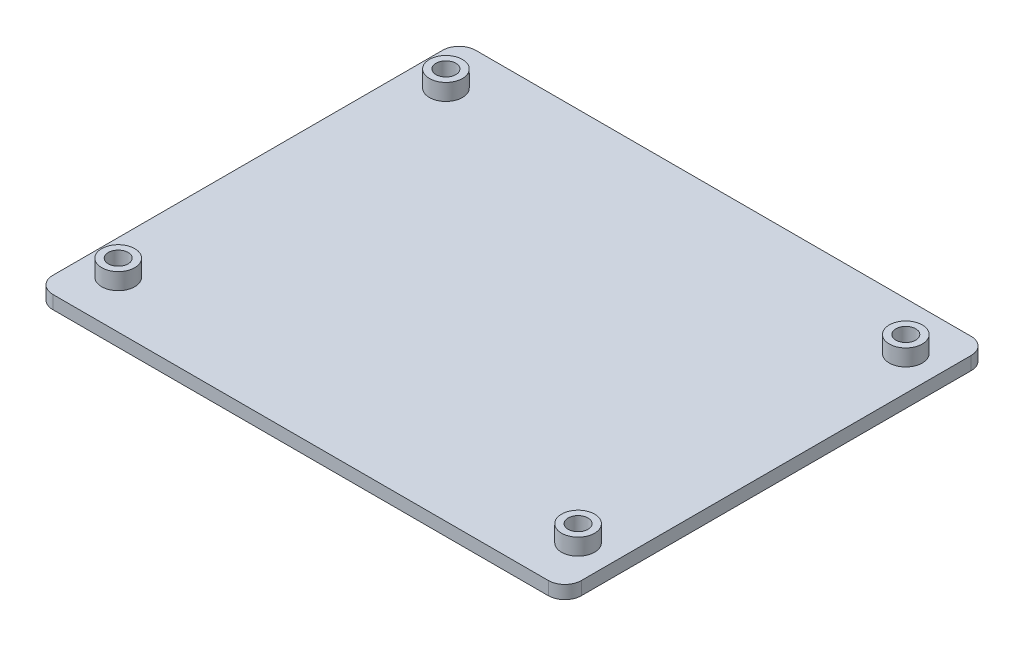
from build123d import *

# Parameters (mm, degrees)
SKETCH1_W           = 80
SKETCH1_H           = 64
BOSS_EXTRUDE1_DEPTH = 2
FILLET1_R           = 2.5
SKETCH2_R           = 1.5
CUT_EXTRUDE1_DEPTH  = 2
BOSS_EXTRUDE2_START = 2.5
SKETCH3_R           = 2.5
SKETCH3_R_2         = 1.5
BOSS_EXTRUDE2_DEPTH = 2.5


with BuildPart() as part:
    # Sketch1 → Boss-Extrude1 (new body)
    with BuildSketch(Plane(origin=(0, 0, 0), x_dir=(1, 0, 0), z_dir=(0, 1, 0))):
        Rectangle(SKETCH1_W, SKETCH1_H)
    extrude(amount=BOSS_EXTRUDE1_DEPTH)

    # Fillet1
    fillet1_edges = [part.edges().sort_by_distance(p)[0] for p in [
        (40, 1, 32),
        (-40, 1, 32),
        (-40, 1, -32),
        (40, 1, -32),
    ]]
    fillet(fillet1_edges, radius=FILLET1_R)

    # Sketch2 → Cut-Extrude1 (cut)
    with BuildSketch(Plane(origin=(-9.018883196, 2, 9.463275917), x_dir=(1, 0, 0), z_dir=(0, 1, 0))):
        with Locations(Location((-25.781116804, 34.263275917, 0), (0, 0, 270))):
            Circle(SKETCH2_R)
        with Locations(Location((43.818883196, 34.263275917, 0), (0, 0, 270))):
            Circle(SKETCH2_R)
        with Locations(Location((43.818883196, -15.336724083, 0), (0, 0, 270))):
            Circle(SKETCH2_R)
        with Locations(Location((-25.781116804, -15.336724083, 0), (0, 0, 270))):
            Circle(SKETCH2_R)
    extrude(amount=-CUT_EXTRUDE1_DEPTH, mode=Mode.SUBTRACT)

    # Sketch3 → Boss-Extrude2 (add)
    # profile 1 of 4: a face of its own
    with BuildSketch(Plane(origin=(0, 2, 0), x_dir=(1, 0, 0), z_dir=(0, 1, 0)).offset(BOSS_EXTRUDE2_START)):
        with Locations(Location((-34.8, 24.8, 0), (0, 0, 90))):
            Circle(SKETCH3_R)
        with Locations(Location((-34.8, 24.8, 0), (0, 0, 270))):
            Circle(SKETCH3_R_2, mode=Mode.SUBTRACT)
    # profile 2 of 4: a face of its own
    with BuildSketch(Plane(origin=(0, 2, 0), x_dir=(1, 0, 0), z_dir=(0, 1, 0)).offset(BOSS_EXTRUDE2_START)):
        with Locations(Location((-34.8, -24.8, 0), (0, 0, 90))):
            Circle(SKETCH3_R)
        with Locations(Location((-34.8, -24.8, 0), (0, 0, 270))):
            Circle(SKETCH3_R_2, mode=Mode.SUBTRACT)
    # profile 3 of 4: a face of its own
    with BuildSketch(Plane(origin=(0, 2, 0), x_dir=(1, 0, 0), z_dir=(0, 1, 0)).offset(BOSS_EXTRUDE2_START)):
        with Locations(Location((34.8, 24.8, 0), (0, 0, 90))):
            Circle(SKETCH3_R)
        with Locations(Location((34.8, 24.8, 0), (0, 0, 270))):
            Circle(SKETCH3_R_2, mode=Mode.SUBTRACT)
    # profile 4 of 4: a face of its own
    with BuildSketch(Plane(origin=(0, 2, 0), x_dir=(1, 0, 0), z_dir=(0, 1, 0)).offset(BOSS_EXTRUDE2_START)):
        with Locations(Location((34.8, -24.8, 0), (0, 0, 90))):
            Circle(SKETCH3_R)
        with Locations(Location((34.8, -24.8, 0), (0, 0, 270))):
            Circle(SKETCH3_R_2, mode=Mode.SUBTRACT)
    extrude(amount=-BOSS_EXTRUDE2_DEPTH)


solid = part.part
